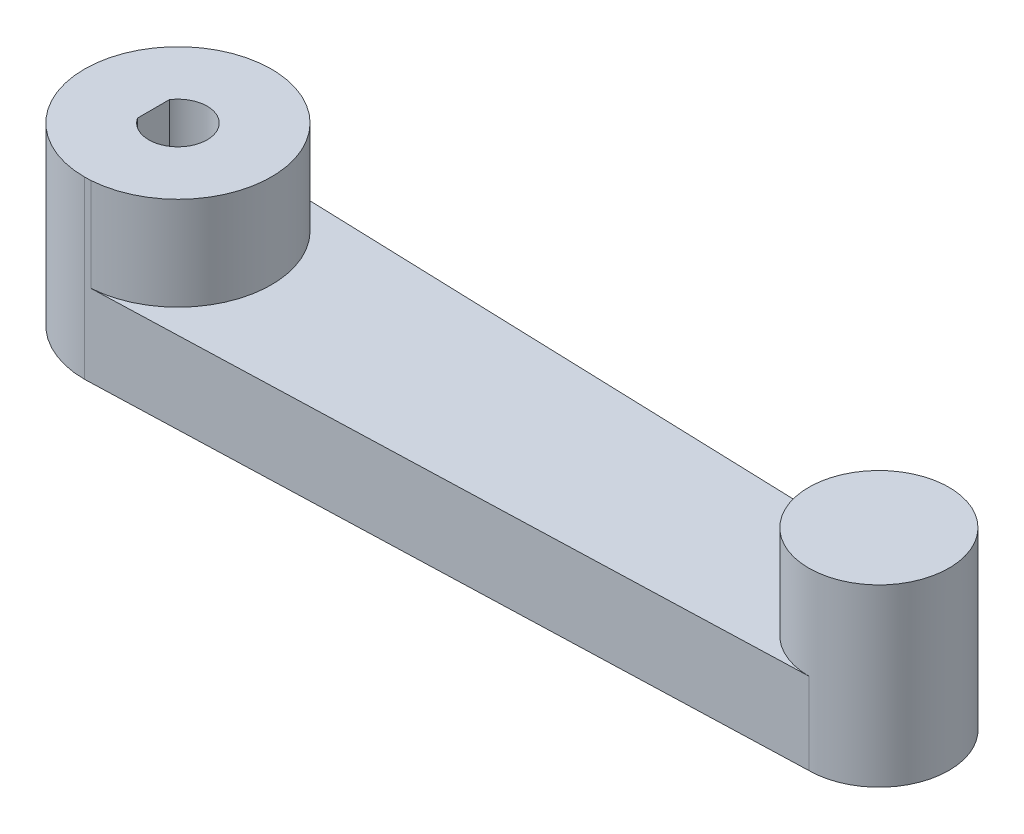
from build123d import *

# Parameters (mm, degrees)
SKETCH1_R           = 5
BOSS_EXTRUDE1_DEPTH = 15
CUT_EXTRUDE1_DEPTH  = 17.583123952
SKETCH3_R           = 3.558152216
BOSS_EXTRUDE2_DEPTH = 15
CUT_EXTRUDE3_DEPTH  = 8


with BuildPart() as part:
    # Sketch1 → Boss-Extrude1 (new body)
    with BuildSketch(Plane(origin=(0, 0, 0), x_dir=(1, 0, 0), z_dir=(0, 1, 0))):
        with Locations(Location((0, 0, 0), (0, 0, 270))):
            Circle(SKETCH1_R)
    extrude(amount=BOSS_EXTRUDE1_DEPTH)

    # Sketch2 → Cut-Extrude1 (cut, through all)
    with BuildSketch(Plane(origin=(0, 15, 0), x_dir=(1, 0, 0), z_dir=(0, 1, 0))):
        with BuildLine():
            Line((-2.096780408, 1.361437447), (-2.096780408, -1.361437447))
            ThreePointArc((-2.096780408, -1.361437447), (2.5, 0), (-2.096780408, 1.361437447))
        make_face()
    extrude(amount=-CUT_EXTRUDE1_DEPTH, mode=Mode.SUBTRACT)

    # Sketch3 → Boss-Extrude2 (add)
    with BuildSketch(Plane(origin=(0, 15, 0), x_dir=(1, 0, 0), z_dir=(0, 1, 0))):
        with BuildLine():
            Line((0, 8), (60, 6))
            ThreePointArc((60, 6), (66, 0), (60, -6))
            Line((60, -6), (0, -8))
            ThreePointArc((0, -8), (-8, 0), (0, 8))
        make_face()
        Circle(SKETCH3_R, mode=Mode.SUBTRACT)
    extrude(amount=-BOSS_EXTRUDE2_DEPTH)

    # Sketch5 → Cut-Extrude3 (cut)
    with BuildSketch(Plane(origin=(0, 15, 0), x_dir=(1, 0, 0), z_dir=(0, 1, 0))):
        with BuildLine():
            Line((60, 6), (0.532741398, 7.982241953))
            ThreePointArc((0.532741398, 7.982241953), (8, 0), (0.532741398, -7.982241953))
            Line((0.532741398, -7.982241953), (60, -6))
            ThreePointArc((60, -6), (54, 0), (60, 6))
        make_face()
    extrude(amount=-CUT_EXTRUDE3_DEPTH, mode=Mode.SUBTRACT)


solid = part.part
